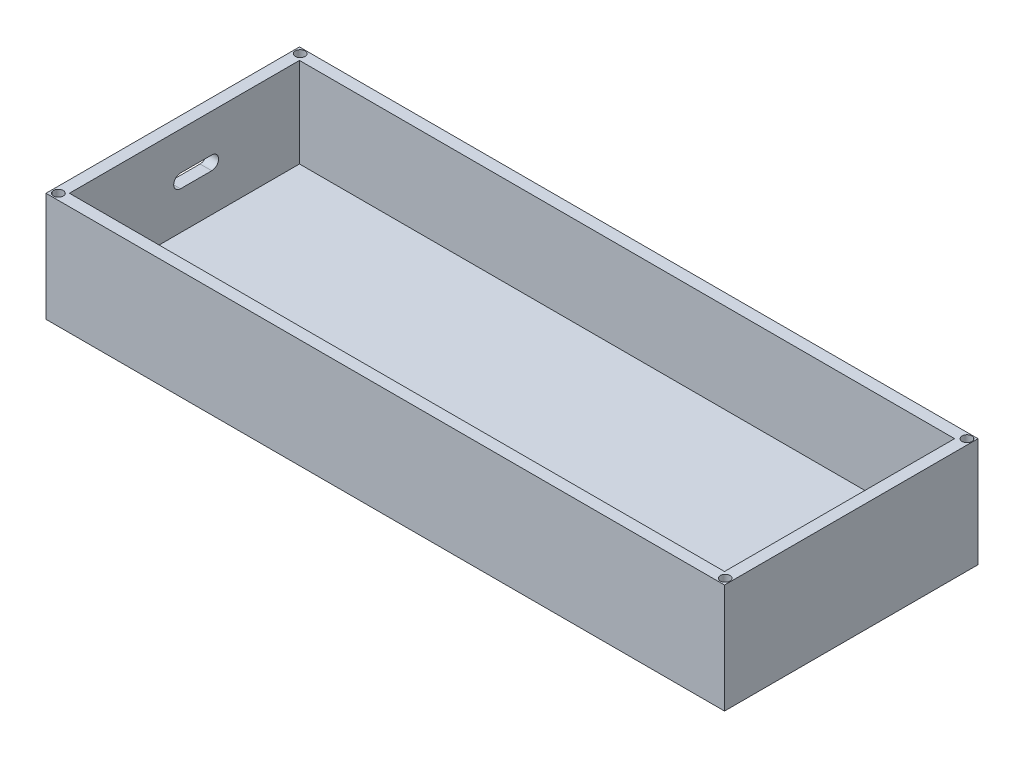
from build123d import *

# Parameters (mm, degrees)
SKETCH1_W            = 174
SKETCH1_H            = 65
BOSS_EXTRUDE1_DEPTH  = 5
SKETCH2_W            = 174
SKETCH2_H            = 65
SKETCH2_W_2          = 168
SKETCH2_H_2          = 59
BOSS_EXTRUDE2_DEPTH  = 23
CUT_EXTRUDE1_DEPTH   = 23
SKETCH4_R            = 1.25
CUT_EXTRUDE2_DEPTH   = 4
LPATTERN1_COUNT      = 2
LPATTERN1_PITCH      = 62
LPATTERN1_COUNT_DIR2 = 2
LPATTERN1_PITCH_DIR2 = 171


with BuildPart() as part:
    # Sketch1 → Boss-Extrude1 (new body)
    with BuildSketch(Plane(origin=(0, 0, 0), x_dir=(1, 0, 0), z_dir=(0, 1, 0))):
        with Locations((43.485355649, -1.4958159)):
            Rectangle(SKETCH1_W, SKETCH1_H)
    extrude(amount=BOSS_EXTRUDE1_DEPTH)

    # Sketch2 → Boss-Extrude2 (add)
    with BuildSketch(Plane(origin=(0, 5, 0), x_dir=(1, 0, 0), z_dir=(0, 1, 0))):
        with Locations((43.485355649, -1.4958159)):
            Rectangle(SKETCH2_W, SKETCH2_H)
        with Locations((43.485355649, -1.4958159)):
            Rectangle(SKETCH2_W_2, SKETCH2_H_2, mode=Mode.SUBTRACT)
    extrude(amount=BOSS_EXTRUDE2_DEPTH)

    # Sketch3 → Cut-Extrude1 (cut)
    with BuildSketch(Plane.ZY.offset(43.514644351)):
        with BuildLine():
            Line((-5.5041841, 18.25), (2.4958159, 18.25))
            ThreePointArc((2.4958159, 18.25), (4.2458159, 16.5), (2.4958159, 14.75))
            Line((2.4958159, 14.75), (-5.5041841, 14.75))
            ThreePointArc((-5.5041841, 14.75), (-7.2541841, 16.5), (-5.5041841, 18.25))
        make_face()
    extrude(amount=-CUT_EXTRUDE1_DEPTH, mode=Mode.SUBTRACT)

    # Sketch4 → Cut-Extrude2 (cut)
    with BuildSketch(Plane(origin=(0, 28, 0), x_dir=(1, 0, 0), z_dir=(0, 1, 0))):
        with Locations(Location((-41.928857914, -32.410029462, 0), (0, 0, 270))):
            Circle(SKETCH4_R)
    cut_extrude2 = extrude(amount=-CUT_EXTRUDE2_DEPTH, mode=Mode.SUBTRACT)

    # LPattern1: Cut-Extrude2 2 × 2
    with Locations(*[(j * LPATTERN1_PITCH_DIR2, 0, -i * LPATTERN1_PITCH) for i in range(LPATTERN1_COUNT) for j in range(LPATTERN1_COUNT_DIR2) if (i, j) != (0, 0)]):
        add(cut_extrude2, mode=Mode.SUBTRACT)


solid = part.part
